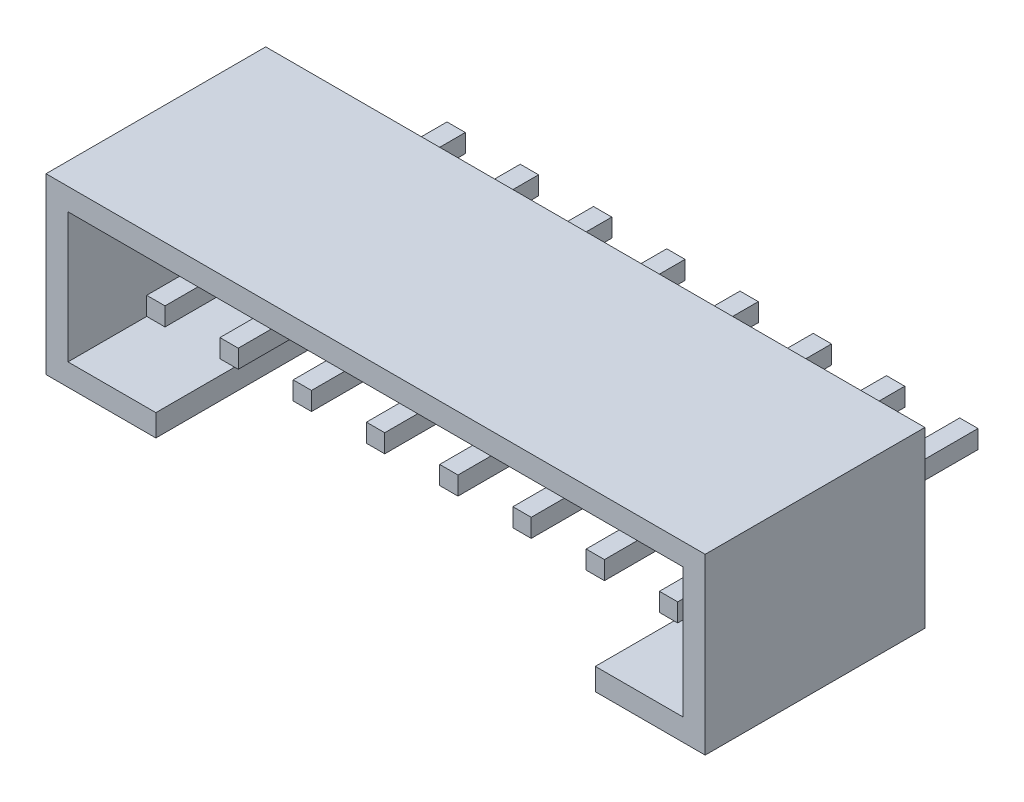
from build123d import *

# Parameters (mm, degrees)
SKETCH1_W           = 18
SKETCH1_H           = 4.75
BOSS_EXTRUDE1_DEPTH = 1.8
BOSS_EXTRUDE2_DEPTH = 4.2
BOSS_EXTRUDE3_START = -5
SKETCH3_W           = 0.5
SKETCH3_H           = 0.5
BOSS_EXTRUDE3_DEPTH = 8.2
LPATTERN1_COUNT     = 8
LPATTERN1_PITCH     = 2


with BuildPart() as part:
    # Sketch1 → Boss-Extrude1 (new body)
    with BuildSketch(Plane.XY):
        Rectangle(SKETCH1_W, SKETCH1_H)
    extrude(amount=BOSS_EXTRUDE1_DEPTH)

    # Sketch2 → Boss-Extrude2 (add)
    with BuildSketch(Plane.XY.offset(1.8)):
        Polygon((-6, -2.375), (-6, -1.775), (-8.4, -1.775), (-8.4, 1.775), (8.4, 1.775), (8.4, -1.775), (6, -1.775), (6, -2.375), (9, -2.375), (9, 2.375), (-9, 2.375), (-9, -2.375), align=None)
    extrude(amount=BOSS_EXTRUDE2_DEPTH)

    # Sketch3 → Boss-Extrude3 (add)
    with BuildSketch(Plane.XY.offset(1.8).offset(BOSS_EXTRUDE3_START)):
        with Locations((-7, -0.375)):
            Rectangle(SKETCH3_W, SKETCH3_H)
    boss_extrude3 = extrude(amount=BOSS_EXTRUDE3_DEPTH)

    # LPattern1: Boss-Extrude3 ×8
    with Locations(*[(i * LPATTERN1_PITCH, 0, 0) for i in range(1, LPATTERN1_COUNT)]):
        add(boss_extrude3)


solid = part.part
